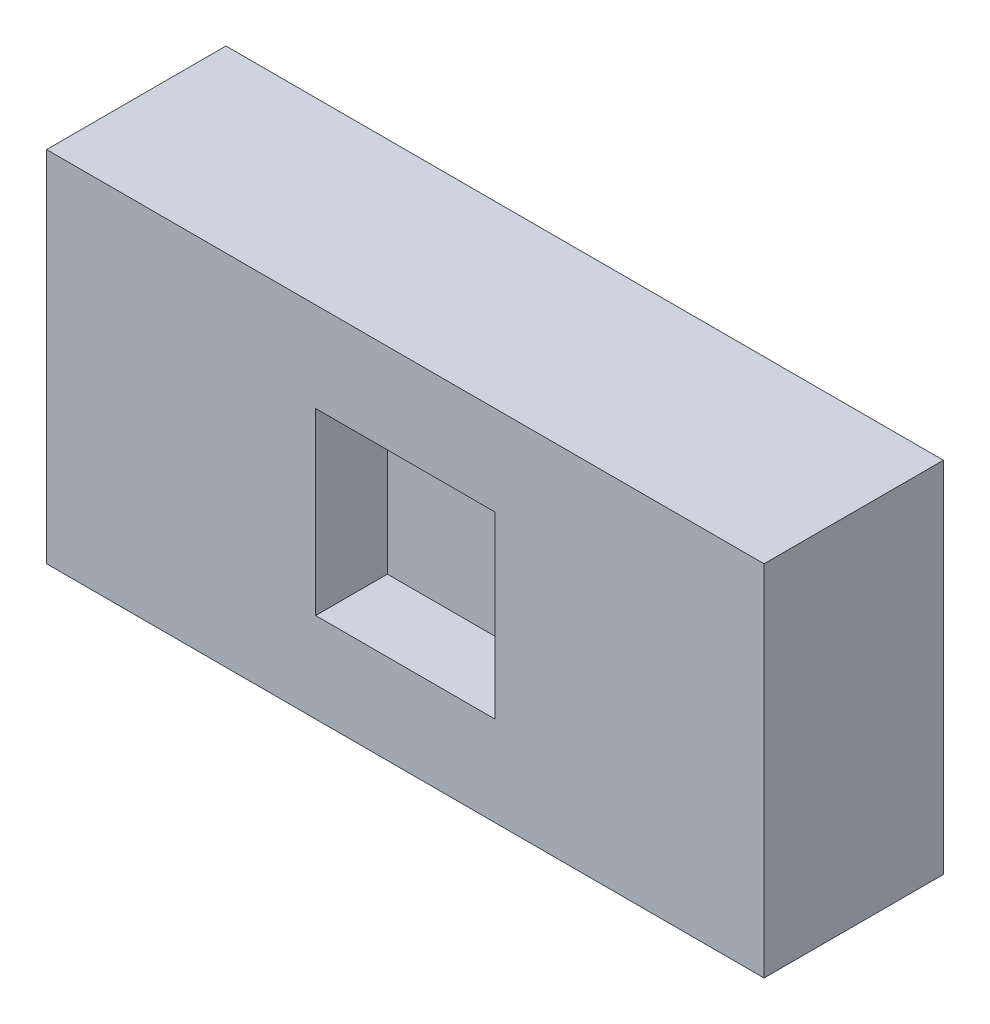
from build123d import *

# Parameters (mm, degrees)
RECTANGLESKETCH_W = 40
RECTANGLESKETCH_H = 20
BLINDBOSS_DEPTH   = 10
CUTSKETCH_W       = 10
CUTSKETCH_H       = 10
BLINDCUT_DEPTH    = 4


with BuildPart() as part:
    # RectangleSketch → BlindBoss (new body)
    with BuildSketch(Plane.XY):
        with Locations((20, 10)):
            Rectangle(RECTANGLESKETCH_W, RECTANGLESKETCH_H)
    extrude(amount=BLINDBOSS_DEPTH)

    # CutSketch → BlindCut (cut)
    with BuildSketch(Plane.XY.offset(10)):
        with Locations((20, 10)):
            Rectangle(CUTSKETCH_W, CUTSKETCH_H)
    extrude(amount=-BLINDCUT_DEPTH, mode=Mode.SUBTRACT)


solid = part.part
